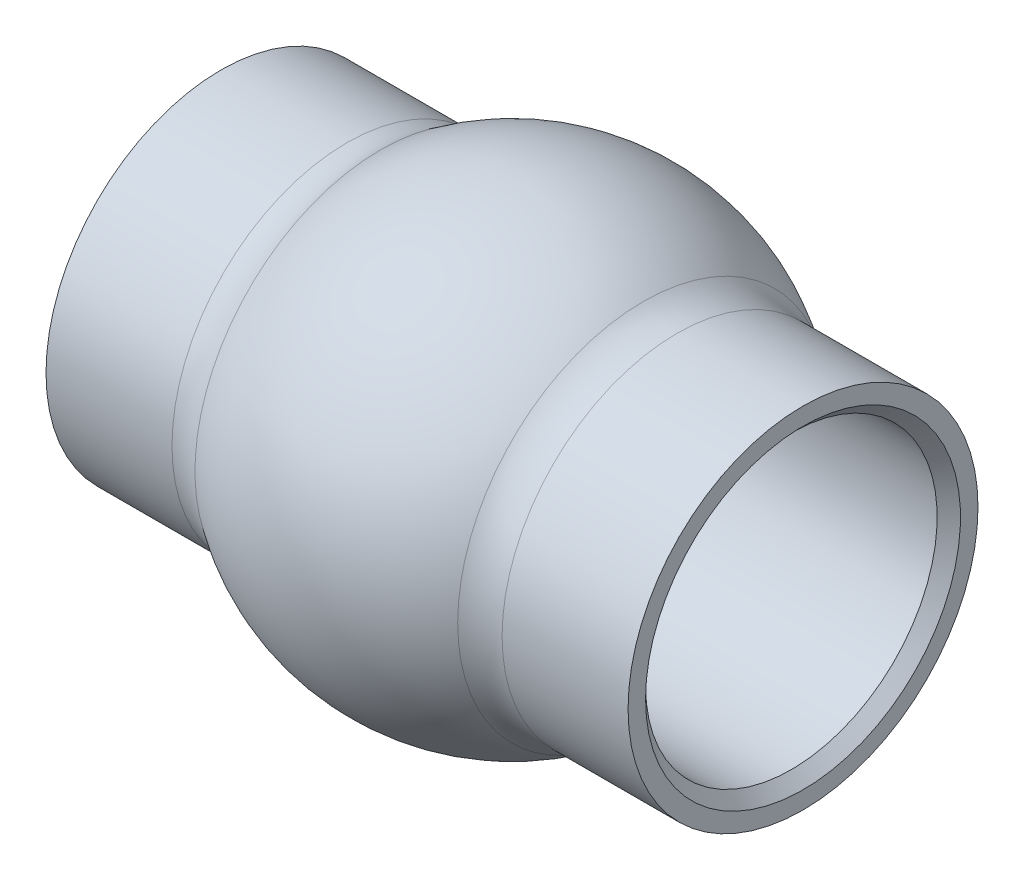
from build123d import *

# Parameters (mm, degrees)
FILLET1_R     = 2.54
CHAMFER1_SIZE = 0.508


with BuildPart() as part:
    # Sketch1 → Revolve1 (revolve)
    with BuildSketch(Plane.XY, mode=Mode.PRIVATE) as revolve1_sk:
        with BuildLine():
            Line((-12.6746, 6.35), (12.6746, 6.35))
            Line((12.6746, 6.35), (12.6746, 7.62))
            Line((12.6746, 7.62), (6.329647384, 7.62))
            ThreePointArc((6.329647384, 7.62), (0, 9.906), (-6.329647384, 7.62))
            Line((-6.329647384, 7.62), (-12.6746, 7.62))
            Line((-12.6746, 7.62), (-12.6746, 6.35))
        make_face()
    revolve(revolve1_sk.sketch.rotate(Axis((-29.740184884, 0, 0), (1, 0, 0)), 90), axis=Axis((-29.740184884, 0, 0), (1, 0, 0)))

    # Fillet1
    fillet1_edges = [part.edges().sort_by_distance(p)[0] for p in [
        (-6.329647384, 0, -7.62),
        (6.329647384, 0, -7.62),
    ]]
    fillet(fillet1_edges, radius=FILLET1_R)

    # Chamfer1
    chamfer1_edges = [part.edges().sort_by_distance(p)[0] for p in [
        (12.6746, 0, -6.35),
        (-12.6746, 0, -6.35),
    ]]
    chamfer(chamfer1_edges, length=CHAMFER1_SIZE)


solid = part.part
